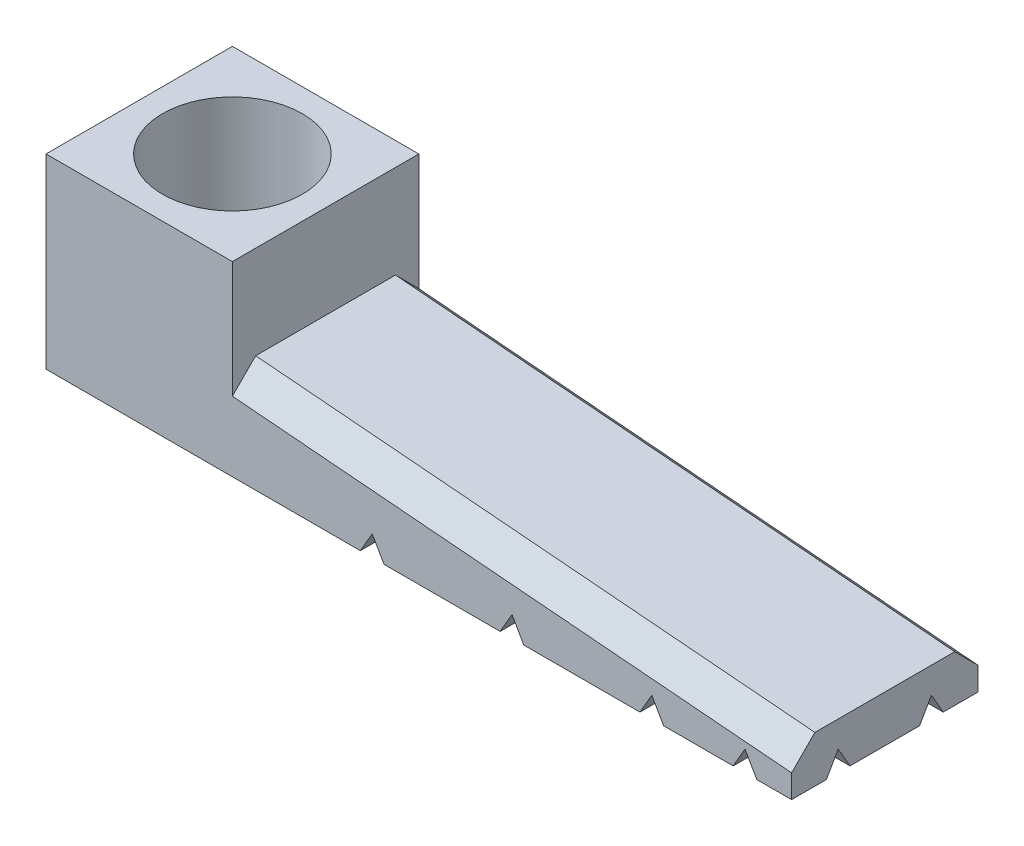
from build123d import *

# Parameters (mm, degrees)
BOSS_EXTRUDE1_DEPTH = 20
CHAMFER1_SIZE       = 2.5
SKETCH2_R           = 7.5
CUT_EXTRUDE1_DEPTH  = 85.852813742
CUT_EXTRUDE2_DEPTH  = 60
CUT_EXTRUDE3_DEPTH  = 85.852813742


with BuildPart() as part:
    # Sketch1 → Boss-Extrude1 (new body)
    with BuildSketch(Plane.XY):
        Polygon((0, 0), (0, 20), (20, 20), (20, 10), (80, 5), (80, 0), align=None)
    extrude(amount=BOSS_EXTRUDE1_DEPTH)

    # Chamfer1
    chamfer1_edges = [part.edges().sort_by_distance(p)[0] for p in [
        (50, 7.5, 20),
        (50, 7.5, 0),
    ]]
    chamfer(chamfer1_edges, length=CHAMFER1_SIZE)

    # Sketch2 → Cut-Extrude1 (cut, through all)
    with BuildSketch(Plane(origin=(0, 0, 0), x_dir=(-1, 0, 0), z_dir=(0, -1, 0))):
        with Locations(Location((-10, -10, 0), (0, 0, 90))):
            Circle(SKETCH2_R)
    extrude(amount=-CUT_EXTRUDE1_DEPTH, mode=Mode.SUBTRACT)

    # Sketch3 → Cut-Extrude2 (cut)
    with BuildSketch(Plane(origin=(80, 0, 0), x_dir=(0, 0, -1), z_dir=(1, 0, 0))):
        Polygon((-15, 2.199704526), (-16.27, 0), (-13.73, 0), align=None)
        Polygon((-6.27, 0), (-5, 2.199704526), (-3.73, 0), align=None)
    extrude(amount=-CUT_EXTRUDE2_DEPTH, mode=Mode.SUBTRACT)

    # Sketch4 → Cut-Extrude3 (cut, through all)
    with BuildSketch(Plane.XY):
        Polygon((75, 2.199704526), (73.73, 0), (76.27, 0), align=None)
        Polygon((65, 2.199704526), (63.73, 0), (66.27, 0), align=None)
        Polygon((50, 2.199704526), (48.73, 0), (51.27, 0), align=None)
        Polygon((35, 2.199704526), (33.73, 0), (36.27, 0), align=None)
    extrude(amount=CUT_EXTRUDE3_DEPTH, mode=Mode.SUBTRACT)


solid = part.part
